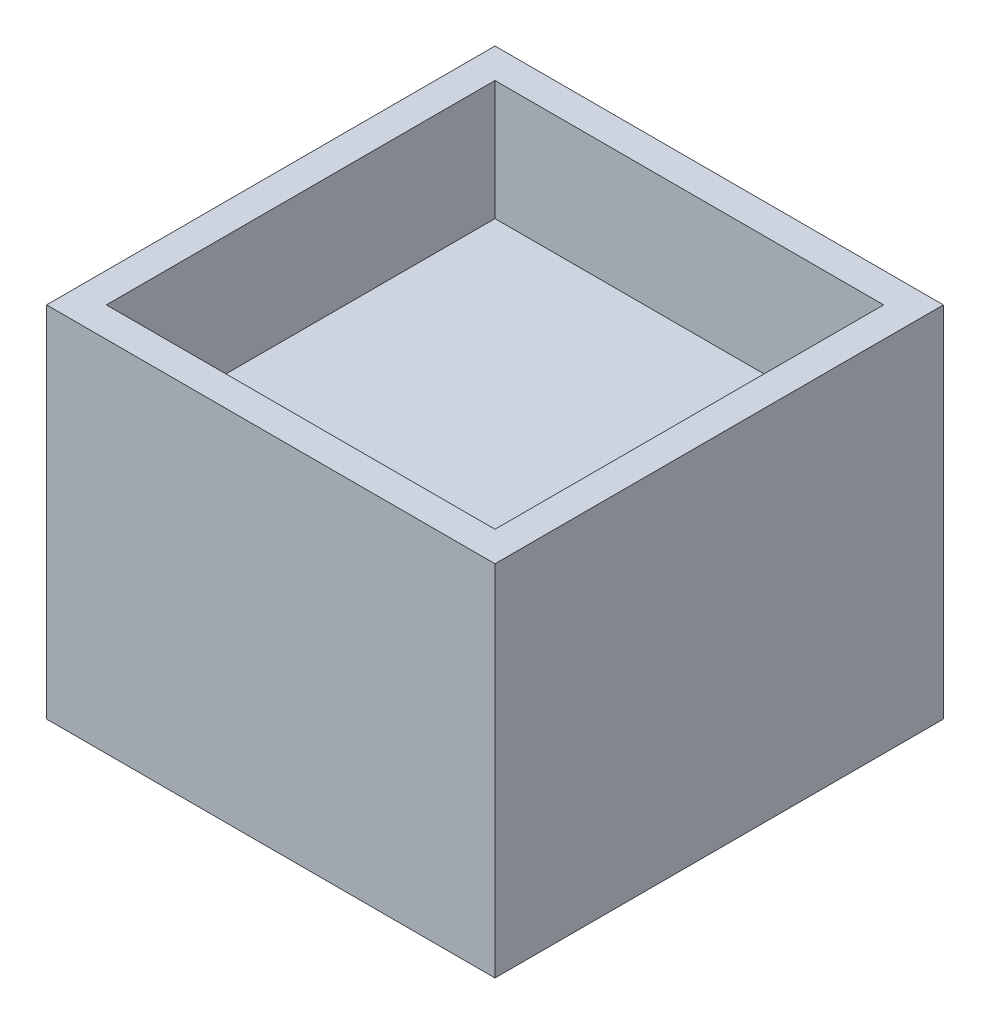
from build123d import *

# Parameters (mm, degrees)
SKETCH1_W           = 750
SKETCH1_H           = 750
BOSS_EXTRUDE1_DEPTH = 600
SKETCH2_W           = 650
SKETCH2_H           = 650
CUT_EXTRUDE1_DEPTH  = 200


with BuildPart() as part:
    # Sketch1 → Boss-Extrude1 (new body)
    with BuildSketch(Plane(origin=(0, 0, 0), x_dir=(1, 0, 0), z_dir=(0, 1, 0))):
        Rectangle(SKETCH1_W, SKETCH1_H)
    extrude(amount=BOSS_EXTRUDE1_DEPTH)

    # Sketch2 → Cut-Extrude1 (cut)
    with BuildSketch(Plane(origin=(0, 600, 0), x_dir=(1, 0, 0), z_dir=(0, 1, 0))):
        Rectangle(SKETCH2_W, SKETCH2_H)
    extrude(amount=-CUT_EXTRUDE1_DEPTH, mode=Mode.SUBTRACT)


solid = part.part
